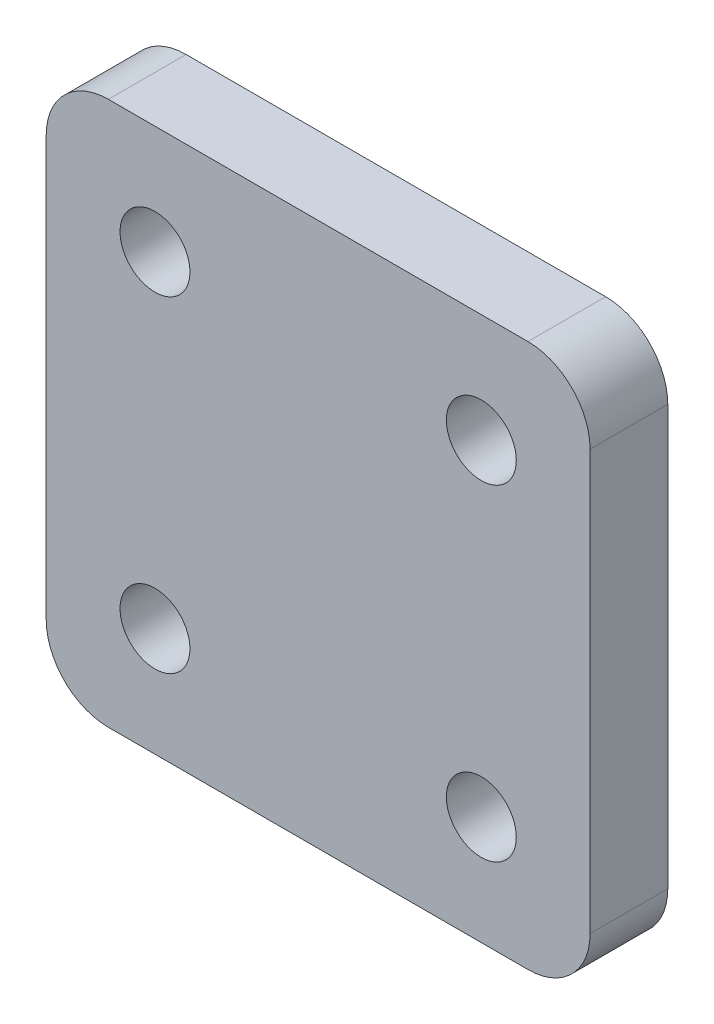
from build123d import *

# Parameters (mm, degrees)
SKETCH1_W           = 35
SKETCH1_H           = 35
SKETCH1_R           = 2.25
BOSS_EXTRUDE1_DEPTH = 5
FILLET1_R           = 4
SKETCH2_R           = 9.5
CUT_EXTRUDE1_DEPTH  = 3


with BuildPart() as part:
    # Sketch1 → Boss-Extrude1 (new body)
    with BuildSketch(Plane.XY):
        with Locations((-17.5, 239.7)):
            Rectangle(SKETCH1_W, SKETCH1_H)
        with Locations((-7, 250.2)):
            Circle(SKETCH1_R, mode=Mode.SUBTRACT)
        with Locations((-7, 229.2)):
            Circle(SKETCH1_R, mode=Mode.SUBTRACT)
        with Locations((-28, 229.2)):
            Circle(SKETCH1_R, mode=Mode.SUBTRACT)
        with Locations((-28, 250.2)):
            Circle(SKETCH1_R, mode=Mode.SUBTRACT)
    extrude(amount=BOSS_EXTRUDE1_DEPTH)

    # Fillet1
    fillet1_edges = [part.edges().sort_by_distance(p)[0] for p in [
        (0, 222.2, 2.5),
        (-35, 222.2, 2.5),
        (-35, 257.2, 2.5),
        (0, 257.2, 2.5),
    ]]
    fillet(fillet1_edges, radius=FILLET1_R)

    # Sketch2 → Cut-Extrude1 (cut)
    with BuildSketch(Plane(origin=(0, 0, 0), x_dir=(-1, 0, 0), z_dir=(0, 0, -1))):
        with Locations((17.5, 239.7)):
            Circle(SKETCH2_R)
    extrude(amount=-CUT_EXTRUDE1_DEPTH, mode=Mode.SUBTRACT)


solid = part.part
